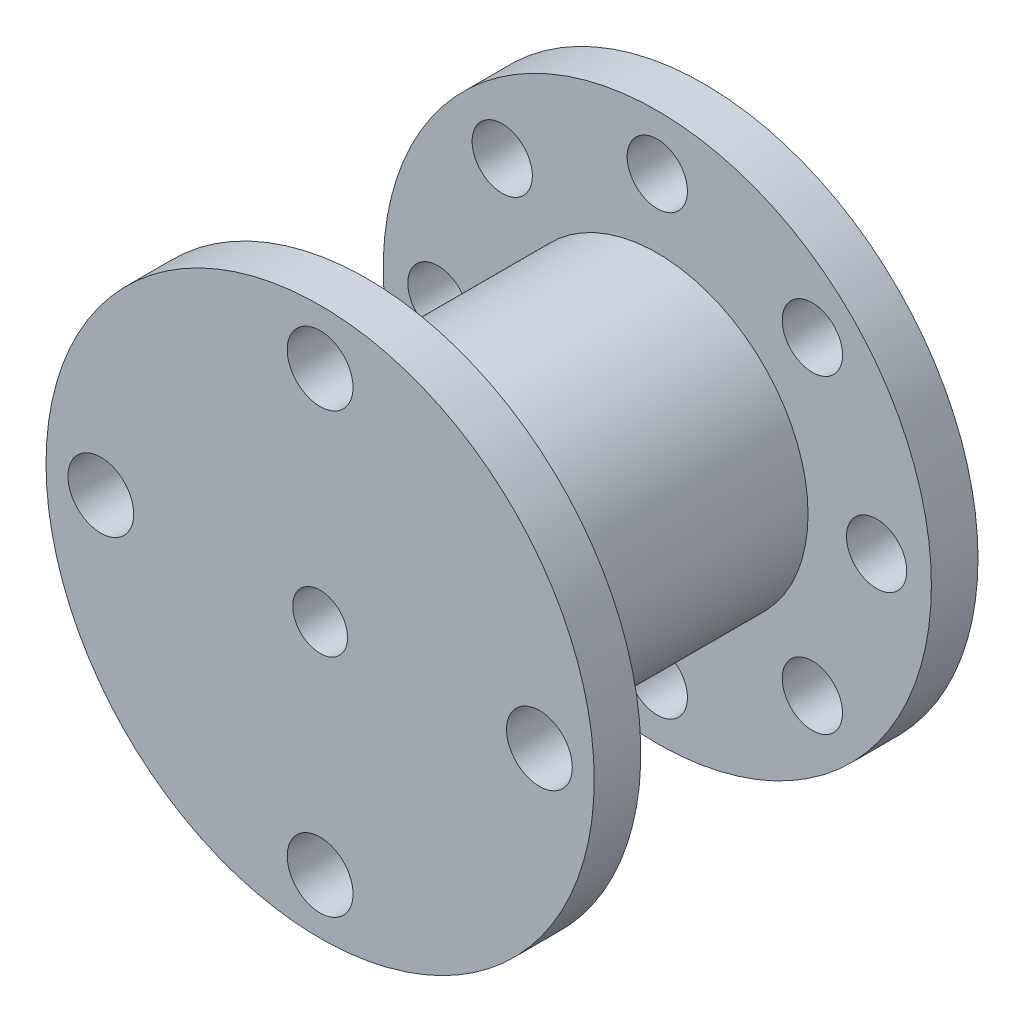
from build123d import *
from build123d.topology import SkipClean

# Parameters (mm, degrees)
BOSS_EXTRU_1_DEPTH      = 3
ENL_V_MAT_EXTRU_2_DEPTH = 2
BOSS_EXTRU_2_DEPTH      = 8
ESQUISSE4_R             = 10
ESQUISSE4_R_2           = 5.5
BOSS_EXTRU_3_DEPTH      = 3
ESQUISSE5_R             = 1.2
ENL_V_MAT_EXTRU_3_DEPTH = 3
ENL_V_MAT_EXTRU_4_DEPTH = 14
ENL_V_START             = -1.3
ESQUISSE7_R             = 1.1
ENL_V_MAT_EXTRU_5_DEPTH = 1.3
ENL_V_MAT_EXTRU_6_DEPTH = 1
ENL_V_MAT_EXTRU_7_DEPTH = 1.3


with BuildPart() as part:
    # Esquisse1 → Boss.-Extru.1 (new body)
    with BuildSketch(Plane.XY):
        with BuildLine():
            Line((22.149661623, 27.880169066), (22.149661623, 26.980169066))
            ThreePointArc((22.149661623, 26.980169066), (22.927479082, 26.657986525), (23.249661623, 25.880169066))
            ThreePointArc((23.249661623, 25.880169066), (22.927479082, 25.102351606), (22.149661623, 24.780169066))
            Line((22.149661623, 24.780169066), (22.149661623, 17.880169066))
            Line((22.149661623, 17.880169066), (27.028698413, 22.759205856))
            ThreePointArc((27.028698413, 22.759205856), (27.028698413, 24.314840775), (28.584333332, 24.314840775))
            Line((28.584333332, 24.314840775), (29.220729435, 24.951236878))
            ThreePointArc((29.220729435, 24.951236878), (25.976495947, 27.118964391), (22.149661623, 27.880169066))
        make_face()
        with BuildLine():
            ThreePointArc((22.149661623, 24.780169066), (21.049661623, 25.880169066), (22.149661623, 26.980169066))
            Line((22.149661623, 26.980169066), (22.149661623, 27.880169066))
            ThreePointArc((22.149661623, 27.880169066), (18.322827299, 27.118964391), (15.078593811, 24.951236878))
            Line((15.078593811, 24.951236878), (15.714989914, 24.314840775))
            ThreePointArc((15.714989914, 24.314840775), (16.913759149, 24.553290801), (17.592807374, 23.537023315))
            ThreePointArc((17.592807374, 23.537023315), (17.509074859, 23.11607154), (17.270624833, 22.759205856))
            Line((17.270624833, 22.759205856), (22.149661623, 17.880169066))
            Line((22.149661623, 17.880169066), (22.149661623, 24.780169066))
        make_face()
        with BuildLine():
            Line((27.028698413, 22.759205856), (22.149661623, 17.880169066))
            Line((22.149661623, 17.880169066), (29.049661623, 17.880169066))
            ThreePointArc((29.049661623, 17.880169066), (30.149661623, 18.980169066), (31.249661623, 17.880169066))
            Line((31.249661623, 17.880169066), (32.149661623, 17.880169066))
            ThreePointArc((32.149661623, 17.880169066), (31.388456948, 21.707003389), (29.220729435, 24.951236878))
            Line((29.220729435, 24.951236878), (28.584333332, 24.314840775))
            ThreePointArc((28.584333332, 24.314840775), (28.822783358, 23.957975091), (28.906515873, 23.537023315))
            ThreePointArc((28.906515873, 23.537023315), (28.227467648, 22.520755829), (27.028698413, 22.759205856))
        make_face()
        with BuildLine():
            Line((15.249661623, 17.880169066), (22.149661623, 17.880169066))
            Line((22.149661623, 17.880169066), (17.270624833, 22.759205856))
            ThreePointArc((17.270624833, 22.759205856), (15.714989914, 22.759205856), (15.714989914, 24.314840775))
            Line((15.714989914, 24.314840775), (15.078593811, 24.951236878))
            ThreePointArc((15.078593811, 24.951236878), (12.910866298, 21.707003389), (12.149661623, 17.880169066))
            Line((12.149661623, 17.880169066), (13.049661623, 17.880169066))
            ThreePointArc((13.049661623, 17.880169066), (14.149661623, 18.980169066), (15.249661623, 17.880169066))
        make_face()
        with BuildLine():
            Line((29.049661623, 17.880169066), (22.149661623, 17.880169066))
            Line((22.149661623, 17.880169066), (27.028698413, 13.001132276))
            ThreePointArc((27.028698413, 13.001132276), (28.227467648, 13.239582302), (28.906515873, 12.223314816))
            ThreePointArc((28.906515873, 12.223314816), (28.822783358, 11.802363041), (28.584333332, 11.445497357))
            Line((28.584333332, 11.445497357), (29.220729435, 10.809101254))
            ThreePointArc((29.220729435, 10.809101254), (31.388456948, 14.053334742), (32.149661623, 17.880169066))
            Line((32.149661623, 17.880169066), (31.249661623, 17.880169066))
            ThreePointArc((31.249661623, 17.880169066), (30.149661623, 16.780169066), (29.049661623, 17.880169066))
        make_face()
        with BuildLine():
            Line((27.028698413, 13.001132276), (22.149661623, 17.880169066))
            Line((22.149661623, 17.880169066), (22.149661623, 10.980169066))
            ThreePointArc((22.149661623, 10.980169066), (22.927479082, 10.657986525), (23.249661623, 9.880169066))
            ThreePointArc((23.249661623, 9.880169066), (22.927479082, 9.102351606), (22.149661623, 8.780169066))
            Line((22.149661623, 8.780169066), (22.149661623, 7.880169066))
            ThreePointArc((22.149661623, 7.880169066), (25.976495947, 8.641373741), (29.220729435, 10.809101254))
            Line((29.220729435, 10.809101254), (28.584333332, 11.445497357))
            ThreePointArc((28.584333332, 11.445497357), (27.028698413, 11.445497357), (27.028698413, 13.001132276))
        make_face()
        with BuildLine():
            Line((22.149661623, 10.980169066), (22.149661623, 17.880169066))
            Line((22.149661623, 17.880169066), (17.270624833, 13.001132276))
            ThreePointArc((17.270624833, 13.001132276), (17.509074859, 12.644266592), (17.592807374, 12.223314816))
            ThreePointArc((17.592807374, 12.223314816), (16.913759149, 11.20704733), (15.714989914, 11.445497357))
            Line((15.714989914, 11.445497357), (15.078593811, 10.809101254))
            ThreePointArc((15.078593811, 10.809101254), (18.322827299, 8.641373741), (22.149661623, 7.880169066))
            Line((22.149661623, 7.880169066), (22.149661623, 8.780169066))
            ThreePointArc((22.149661623, 8.780169066), (21.049661623, 9.880169066), (22.149661623, 10.980169066))
        make_face()
        with BuildLine():
            Line((17.270624833, 13.001132276), (22.149661623, 17.880169066))
            Line((22.149661623, 17.880169066), (15.249661623, 17.880169066))
            ThreePointArc((15.249661623, 17.880169066), (14.149661623, 16.780169066), (13.049661623, 17.880169066))
            Line((13.049661623, 17.880169066), (12.149661623, 17.880169066))
            ThreePointArc((12.149661623, 17.880169066), (12.910866298, 14.053334742), (15.078593811, 10.809101254))
            Line((15.078593811, 10.809101254), (15.714989914, 11.445497357))
            ThreePointArc((15.714989914, 11.445497357), (15.714989914, 13.001132276), (17.270624833, 13.001132276))
        make_face()
    extrude(amount=BOSS_EXTRU_1_DEPTH)

    # Esquisse2 → Enlèv. mat.-Extru.2 (cut)
    with BuildSketch(Plane(origin=(0, 0, 0), x_dir=(-1, 0, 0), z_dir=(0, 0, -1))):
        with BuildLine():
            ThreePointArc((-17.649661623, 17.880169066), (-18.967681108, 21.062149581), (-22.149661623, 22.380169066))
            Line((-22.149661623, 22.380169066), (-22.149661623, 17.880169066))
            Line((-22.149661623, 17.880169066), (-17.649661623, 17.880169066))
        make_face()
        with BuildLine():
            Line((-22.149661623, 17.880169066), (-22.149661623, 22.380169066))
            ThreePointArc((-22.149661623, 22.380169066), (-25.331642138, 21.062149581), (-26.649661623, 17.880169066))
            Line((-26.649661623, 17.880169066), (-22.149661623, 17.880169066))
        make_face()
        with BuildLine():
            Line((-17.649661623, 17.880169066), (-22.149661623, 17.880169066))
            Line((-22.149661623, 17.880169066), (-22.149661623, 13.380169066))
            ThreePointArc((-22.149661623, 13.380169066), (-18.967681108, 14.69818855), (-17.649661623, 17.880169066))
        make_face()
        with BuildLine():
            Line((-22.149661623, 13.380169066), (-22.149661623, 17.880169066))
            Line((-22.149661623, 17.880169066), (-26.649661623, 17.880169066))
            ThreePointArc((-26.649661623, 17.880169066), (-25.331642138, 14.69818855), (-22.149661623, 13.380169066))
        make_face()
    extrude(amount=-ENL_V_MAT_EXTRU_2_DEPTH, mode=Mode.SUBTRACT)

    # Esquisse3 → Boss.-Extru.2 (add)
    with BuildSketch(Plane.XY.offset(3)):
        with BuildLine():
            ThreePointArc((27.649661623, 17.880169066), (26.03874892, 21.769256362), (22.149661623, 23.380169066))
            Line((22.149661623, 23.380169066), (22.149661623, 17.880169066))
            Line((22.149661623, 17.880169066), (27.649661623, 17.880169066))
        make_face()
        with BuildLine():
            Line((22.149661623, 17.880169066), (22.149661623, 23.380169066))
            ThreePointArc((22.149661623, 23.380169066), (18.260574327, 21.769256362), (16.649661623, 17.880169066))
            Line((16.649661623, 17.880169066), (22.149661623, 17.880169066))
        make_face()
        with BuildLine():
            Line((27.649661623, 17.880169066), (22.149661623, 17.880169066))
            Line((22.149661623, 17.880169066), (22.149661623, 12.380169066))
            ThreePointArc((22.149661623, 12.380169066), (26.03874892, 13.991081769), (27.649661623, 17.880169066))
        make_face()
        with BuildLine():
            Line((22.149661623, 12.380169066), (22.149661623, 17.880169066))
            Line((22.149661623, 17.880169066), (16.649661623, 17.880169066))
            ThreePointArc((16.649661623, 17.880169066), (18.260574327, 13.991081769), (22.149661623, 12.380169066))
        make_face()
    extrude(amount=BOSS_EXTRU_2_DEPTH)

    # Esquisse4 → Boss.-Extru.3 (add)
    # profile 1 of 17: a face of its own
    with BuildSketch(Plane.XY.offset(11)):
        with Locations((22.149661623, 17.880169066)):
            Circle(ESQUISSE4_R)
        with Locations((22.149661623, 17.880169066)):
            Circle(ESQUISSE4_R_2, mode=Mode.SUBTRACT)
    # profile 2 of 17: a face of its own
    with BuildSketch(Plane.XY.offset(11)):
        with BuildLine():
            Line((22.149661623, 12.380169066), (22.149661623, 17.880169066))
            Line((22.149661623, 17.880169066), (16.649661623, 17.880169066))
            ThreePointArc((16.649661623, 17.880169066), (18.260574327, 13.991081769), (22.149661623, 12.380169066))
        make_face()
    # profile 3 of 17: a face of its own
    with BuildSketch(Plane.XY.offset(11)):
        with BuildLine():
            Line((27.649661623, 17.880169066), (22.149661623, 17.880169066))
            Line((22.149661623, 17.880169066), (22.149661623, 12.380169066))
            ThreePointArc((22.149661623, 12.380169066), (26.03874892, 13.991081769), (27.649661623, 17.880169066))
        make_face()
    # profile 4 of 17: a face of its own
    with BuildSketch(Plane.XY.offset(11)):
        with BuildLine():
            Line((22.149661623, 17.880169066), (22.149661623, 23.380169066))
            ThreePointArc((22.149661623, 23.380169066), (18.260574327, 21.769256362), (16.649661623, 17.880169066))
            Line((16.649661623, 17.880169066), (22.149661623, 17.880169066))
        make_face()
    # profile 5 of 17: a face of its own
    with BuildSketch(Plane.XY.offset(11)):
        with BuildLine():
            ThreePointArc((27.649661623, 17.880169066), (26.03874892, 21.769256362), (22.149661623, 23.380169066))
            Line((22.149661623, 23.380169066), (22.149661623, 17.880169066))
            Line((22.149661623, 17.880169066), (27.649661623, 17.880169066))
        make_face()
    # profile 6 of 17: a face of its own
    with BuildSketch(Plane.XY.offset(11)):
        with BuildLine():
            Line((22.149661623, 12.380169066), (22.149661623, 17.880169066))
            Line((22.149661623, 17.880169066), (16.649661623, 17.880169066))
            ThreePointArc((16.649661623, 17.880169066), (18.260574327, 13.991081769), (22.149661623, 12.380169066))
        make_face()
    # profile 7 of 17: a face of its own
    with BuildSketch(Plane.XY.offset(11)):
        with BuildLine():
            Line((27.649661623, 17.880169066), (22.149661623, 17.880169066))
            Line((22.149661623, 17.880169066), (22.149661623, 12.380169066))
            ThreePointArc((22.149661623, 12.380169066), (26.03874892, 13.991081769), (27.649661623, 17.880169066))
        make_face()
    # profile 8 of 17: a face of its own
    with BuildSketch(Plane.XY.offset(11)):
        with BuildLine():
            Line((22.149661623, 17.880169066), (22.149661623, 23.380169066))
            ThreePointArc((22.149661623, 23.380169066), (18.260574327, 21.769256362), (16.649661623, 17.880169066))
            Line((16.649661623, 17.880169066), (22.149661623, 17.880169066))
        make_face()
    # profile 9 of 17: a face of its own
    with BuildSketch(Plane.XY.offset(11)):
        with BuildLine():
            ThreePointArc((27.649661623, 17.880169066), (26.03874892, 21.769256362), (22.149661623, 23.380169066))
            Line((22.149661623, 23.380169066), (22.149661623, 17.880169066))
            Line((22.149661623, 17.880169066), (27.649661623, 17.880169066))
        make_face()
    # profile 10 of 17: a face of its own
    with BuildSketch(Plane.XY.offset(11)):
        with BuildLine():
            Line((22.149661623, 12.380169066), (22.149661623, 17.880169066))
            Line((22.149661623, 17.880169066), (16.649661623, 17.880169066))
            ThreePointArc((16.649661623, 17.880169066), (18.260574327, 13.991081769), (22.149661623, 12.380169066))
        make_face()
    # profile 11 of 17: a face of its own
    with BuildSketch(Plane.XY.offset(11)):
        with BuildLine():
            Line((27.649661623, 17.880169066), (22.149661623, 17.880169066))
            Line((22.149661623, 17.880169066), (22.149661623, 12.380169066))
            ThreePointArc((22.149661623, 12.380169066), (26.03874892, 13.991081769), (27.649661623, 17.880169066))
        make_face()
    # profile 12 of 17: a face of its own
    with BuildSketch(Plane.XY.offset(11)):
        with BuildLine():
            Line((22.149661623, 17.880169066), (22.149661623, 23.380169066))
            ThreePointArc((22.149661623, 23.380169066), (18.260574327, 21.769256362), (16.649661623, 17.880169066))
            Line((16.649661623, 17.880169066), (22.149661623, 17.880169066))
        make_face()
    # profile 13 of 17: a face of its own
    with BuildSketch(Plane.XY.offset(11)):
        with BuildLine():
            ThreePointArc((27.649661623, 17.880169066), (26.03874892, 21.769256362), (22.149661623, 23.380169066))
            Line((22.149661623, 23.380169066), (22.149661623, 17.880169066))
            Line((22.149661623, 17.880169066), (27.649661623, 17.880169066))
        make_face()
    # profile 14 of 17: a face of its own
    with BuildSketch(Plane.XY.offset(11)):
        with BuildLine():
            Line((22.149661623, 12.380169066), (22.149661623, 17.880169066))
            Line((22.149661623, 17.880169066), (16.649661623, 17.880169066))
            ThreePointArc((16.649661623, 17.880169066), (18.260574327, 13.991081769), (22.149661623, 12.380169066))
        make_face()
    # profile 15 of 17: a face of its own
    with BuildSketch(Plane.XY.offset(11)):
        with BuildLine():
            Line((27.649661623, 17.880169066), (22.149661623, 17.880169066))
            Line((22.149661623, 17.880169066), (22.149661623, 12.380169066))
            ThreePointArc((22.149661623, 12.380169066), (26.03874892, 13.991081769), (27.649661623, 17.880169066))
        make_face()
    # profile 16 of 17: a face of its own
    with BuildSketch(Plane.XY.offset(11)):
        with BuildLine():
            Line((22.149661623, 17.880169066), (22.149661623, 23.380169066))
            ThreePointArc((22.149661623, 23.380169066), (18.260574327, 21.769256362), (16.649661623, 17.880169066))
            Line((16.649661623, 17.880169066), (22.149661623, 17.880169066))
        make_face()
    # profile 17 of 17: a face of its own
    with BuildSketch(Plane.XY.offset(11)):
        with BuildLine():
            ThreePointArc((27.649661623, 17.880169066), (26.03874892, 21.769256362), (22.149661623, 23.380169066))
            Line((22.149661623, 23.380169066), (22.149661623, 17.880169066))
            Line((22.149661623, 17.880169066), (27.649661623, 17.880169066))
        make_face()
    extrude(amount=BOSS_EXTRU_3_DEPTH)

    # Esquisse5 → Enlèv. mat.-Extru.3 (cut)
    with BuildSketch(Plane.XY.offset(14)):
        with BuildLine():
            ThreePointArc((31.349661623, 17.880169066), (30.149661623, 19.080169066), (28.949661623, 17.880169066))
            Line((28.949661623, 17.880169066), (30.149661623, 17.880169066))
            Line((30.149661623, 17.880169066), (31.349661623, 17.880169066))
        make_face()
        with BuildLine():
            Line((30.149661623, 17.880169066), (28.949661623, 17.880169066))
            ThreePointArc((28.949661623, 17.880169066), (30.149661623, 16.680169066), (31.349661623, 17.880169066))
            Line((31.349661623, 17.880169066), (30.149661623, 17.880169066))
        make_face()
        with Locations((22.149661623, 9.880169066)):
            Circle(ESQUISSE5_R)
        with Locations((22.149661623, 25.880169066)):
            Circle(ESQUISSE5_R)
        with Locations((14.149661623, 17.880169066)):
            Circle(ESQUISSE5_R)
    extrude(amount=-ENL_V_MAT_EXTRU_3_DEPTH, mode=Mode.SUBTRACT)

    # Esquisse6 → Enlèv. mat.-Extru.4 (cut)
    with BuildSketch(Plane.XY.offset(14)):
        with BuildLine():
            ThreePointArc((23.149661623, 17.880169066), (22.856768404, 18.587275847), (22.149661623, 18.880169066))
            Line((22.149661623, 18.880169066), (22.149661623, 17.880169066))
            Line((22.149661623, 17.880169066), (23.149661623, 17.880169066))
        make_face()
        with BuildLine():
            Line((22.149661623, 17.880169066), (22.149661623, 18.880169066))
            ThreePointArc((22.149661623, 18.880169066), (21.442554842, 18.587275847), (21.149661623, 17.880169066))
            Line((21.149661623, 17.880169066), (22.149661623, 17.880169066))
        make_face()
        with BuildLine():
            Line((23.149661623, 17.880169066), (22.149661623, 17.880169066))
            Line((22.149661623, 17.880169066), (22.149661623, 16.880169066))
            ThreePointArc((22.149661623, 16.880169066), (22.856768404, 17.173062285), (23.149661623, 17.880169066))
        make_face()
        with BuildLine():
            Line((22.149661623, 16.880169066), (22.149661623, 17.880169066))
            Line((22.149661623, 17.880169066), (21.149661623, 17.880169066))
            ThreePointArc((21.149661623, 17.880169066), (21.442554842, 17.173062285), (22.149661623, 16.880169066))
        make_face()
    extrude(amount=-ENL_V_MAT_EXTRU_4_DEPTH, mode=Mode.SUBTRACT)

    # Esquisse7 → Enlèv. mat.-Extru.5 (cut)
    # profile 1 of 2: a face of its own
    with SkipClean():  # the faces are left unmerged after this step: merging them gives an invalid solid
        with BuildSketch(Plane.XY.offset(3).offset(ENL_V_START)):
            with BuildLine():
                Line((22.149661623, 26.980169066), (22.149661623, 27.880169066))
                ThreePointArc((22.149661623, 27.880169066), (12.149661623, 17.880169066), (22.149661623, 7.880169066))
                Line((22.149661623, 7.880169066), (22.149661623, 8.780169066))
                ThreePointArc((22.149661623, 8.780169066), (21.049661623, 9.880169066), (22.149661623, 10.980169066))
                Line((22.149661623, 10.980169066), (22.149661623, 12.380169066))
                ThreePointArc((22.149661623, 12.380169066), (16.649661623, 17.880169066), (22.149661623, 23.380169066))
                Line((22.149661623, 23.380169066), (22.149661623, 24.780169066))
                ThreePointArc((22.149661623, 24.780169066), (21.049661623, 25.880169066), (22.149661623, 26.980169066))
            make_face()
            with Locations((16.492807374, 12.223314816)):
                Circle(ESQUISSE7_R, mode=Mode.SUBTRACT)
            with Locations((14.149661623, 17.880169066)):
                Circle(ESQUISSE7_R, mode=Mode.SUBTRACT)
            with Locations((16.492807374, 23.537023315)):
                Circle(ESQUISSE7_R, mode=Mode.SUBTRACT)
        # profile 2 of 2: a face of its own
        with BuildSketch(Plane.XY.offset(3).offset(ENL_V_START)):
            with BuildLine():
                ThreePointArc((32.149661623, 17.880169066), (29.220729435, 24.951236878), (22.149661623, 27.880169066))
                Line((22.149661623, 27.880169066), (22.149661623, 26.980169066))
                ThreePointArc((22.149661623, 26.980169066), (22.927479082, 26.657986525), (23.249661623, 25.880169066))
                ThreePointArc((23.249661623, 25.880169066), (22.927479082, 25.102351606), (22.149661623, 24.780169066))
                Line((22.149661623, 24.780169066), (22.149661623, 23.380169066))
                ThreePointArc((22.149661623, 23.380169066), (26.03874892, 21.769256362), (27.649661623, 17.880169066))
                ThreePointArc((27.649661623, 17.880169066), (26.03874892, 13.991081769), (22.149661623, 12.380169066))
                Line((22.149661623, 12.380169066), (22.149661623, 10.980169066))
                ThreePointArc((22.149661623, 10.980169066), (22.927479082, 10.657986525), (23.249661623, 9.880169066))
                ThreePointArc((23.249661623, 9.880169066), (22.927479082, 9.102351606), (22.149661623, 8.780169066))
                Line((22.149661623, 8.780169066), (22.149661623, 7.880169066))
                ThreePointArc((22.149661623, 7.880169066), (29.220729435, 10.809101254), (32.149661623, 17.880169066))
            make_face()
            with Locations((27.806515873, 12.223314816)):
                Circle(ESQUISSE7_R, mode=Mode.SUBTRACT)
            with Locations((30.149661623, 17.880169066)):
                Circle(ESQUISSE7_R, mode=Mode.SUBTRACT)
            with Locations((27.806515873, 23.537023315)):
                Circle(ESQUISSE7_R, mode=Mode.SUBTRACT)
        extrude(amount=ENL_V_MAT_EXTRU_5_DEPTH, mode=Mode.SUBTRACT)

    # Esquisse8 → Enlèv. mat.-Extru.6 (cut)
    with SkipClean():  # the faces are left unmerged after this step: merging them gives an invalid solid
        with BuildSketch(Plane(origin=(0, 0, 2), x_dir=(-1, 0, 0), z_dir=(0, 0, -1))):
            with BuildLine():
                ThreePointArc((-17.649661623, 17.880169066), (-17.70973137, 18.612985107), (-17.88833689, 19.326236672))
                Line((-17.88833689, 19.326236672), (-21.202700571, 18.201517423))
                ThreePointArc((-21.202700571, 18.201517423), (-21.163010456, 18.043017075), (-21.149661623, 17.880169066))
                ThreePointArc((-21.149661623, 17.880169066), (-21.986813614, 16.893517898), (-23.096622675, 17.558820709))
                Line((-23.096622675, 17.558820709), (-26.410986356, 16.43410146))
                ThreePointArc((-26.410986356, 16.43410146), (-21.416845581, 13.440238813), (-17.649661623, 17.880169066))
            make_face()
            with BuildLine():
                Line((-21.202700571, 18.201517423), (-17.88833689, 19.326236672))
                ThreePointArc((-17.88833689, 19.326236672), (-23.595729229, 22.141493799), (-26.410986356, 16.43410146))
                Line((-26.410986356, 16.43410146), (-23.096622675, 17.558820709))
                ThreePointArc((-23.096622675, 17.558820709), (-22.47100998, 18.827130117), (-21.202700571, 18.201517423))
            make_face()
        extrude(amount=-ENL_V_MAT_EXTRU_6_DEPTH, mode=Mode.SUBTRACT)

    # Esquisse9 → Enlèv. mat.-Extru.7 (cut)
    with BuildSketch(Plane(origin=(0, 0, 11), x_dir=(-1, 0, 0), z_dir=(0, 0, -1))):
        with BuildLine():
            Line((-22.149661623, 27.080169066), (-22.149661623, 27.880169066))
            ThreePointArc((-22.149661623, 27.880169066), (-29.220729435, 24.951236878), (-32.149661623, 17.880169066))
            Line((-32.149661623, 17.880169066), (-31.349661623, 17.880169066))
            ThreePointArc((-31.349661623, 17.880169066), (-30.149661623, 19.080169066), (-28.949661623, 17.880169066))
            Line((-28.949661623, 17.880169066), (-27.649661623, 17.880169066))
            ThreePointArc((-27.649661623, 17.880169066), (-26.03874892, 21.769256362), (-22.149661623, 23.380169066))
            Line((-22.149661623, 23.380169066), (-22.149661623, 24.680169066))
            ThreePointArc((-22.149661623, 24.680169066), (-23.349661623, 25.880169066), (-22.149661623, 27.080169066))
        make_face()
        with BuildLine():
            Line((-32.149661623, 17.880169066), (-22.149661623, 7.880169066))
            Line((-22.149661623, 7.880169066), (-22.149661623, 8.680169066))
            ThreePointArc((-22.149661623, 8.680169066), (-23.349661623, 9.880169066), (-22.149661623, 11.080169066))
            Line((-22.149661623, 11.080169066), (-22.149661623, 12.380169066))
            ThreePointArc((-22.149661623, 12.380169066), (-26.03874892, 13.991081769), (-27.649661623, 17.880169066))
            Line((-27.649661623, 17.880169066), (-28.949661623, 17.880169066))
            ThreePointArc((-28.949661623, 17.880169066), (-30.149661623, 16.680169066), (-31.349661623, 17.880169066))
            Line((-31.349661623, 17.880169066), (-32.149661623, 17.880169066))
        make_face()
        with BuildLine():
            ThreePointArc((-32.149661623, 17.880169066), (-29.220729435, 10.809101254), (-22.149661623, 7.880169066))
            Line((-22.149661623, 7.880169066), (-32.149661623, 17.880169066))
        make_face()
        with BuildLine():
            ThreePointArc((-22.149661623, 7.880169066), (-15.078593811, 10.809101254), (-12.149661623, 17.880169066))
            Line((-12.149661623, 17.880169066), (-12.949661623, 17.880169066))
            ThreePointArc((-12.949661623, 17.880169066), (-14.149661623, 16.680169066), (-15.349661623, 17.880169066))
            Line((-15.349661623, 17.880169066), (-16.649661623, 17.880169066))
            ThreePointArc((-16.649661623, 17.880169066), (-18.260574327, 13.991081769), (-22.149661623, 12.380169066))
            Line((-22.149661623, 12.380169066), (-22.149661623, 11.080169066))
            ThreePointArc((-22.149661623, 11.080169066), (-21.301133486, 10.728697203), (-20.949661623, 9.880169066))
            ThreePointArc((-20.949661623, 9.880169066), (-21.301133486, 9.031640928), (-22.149661623, 8.680169066))
            Line((-22.149661623, 8.680169066), (-22.149661623, 7.880169066))
        make_face()
        with BuildLine():
            Line((-12.949661623, 17.880169066), (-12.149661623, 17.880169066))
            ThreePointArc((-12.149661623, 17.880169066), (-15.078593811, 24.951236878), (-22.149661623, 27.880169066))
            Line((-22.149661623, 27.880169066), (-22.149661623, 27.080169066))
            ThreePointArc((-22.149661623, 27.080169066), (-21.301133486, 26.728697203), (-20.949661623, 25.880169066))
            ThreePointArc((-20.949661623, 25.880169066), (-21.301133486, 25.031640928), (-22.149661623, 24.680169066))
            Line((-22.149661623, 24.680169066), (-22.149661623, 23.380169066))
            ThreePointArc((-22.149661623, 23.380169066), (-18.260574327, 21.769256362), (-16.649661623, 17.880169066))
            Line((-16.649661623, 17.880169066), (-15.349661623, 17.880169066))
            ThreePointArc((-15.349661623, 17.880169066), (-14.149661623, 19.080169066), (-12.949661623, 17.880169066))
        make_face()
    extrude(amount=-ENL_V_MAT_EXTRU_7_DEPTH, mode=Mode.SUBTRACT)


solid = part.part
